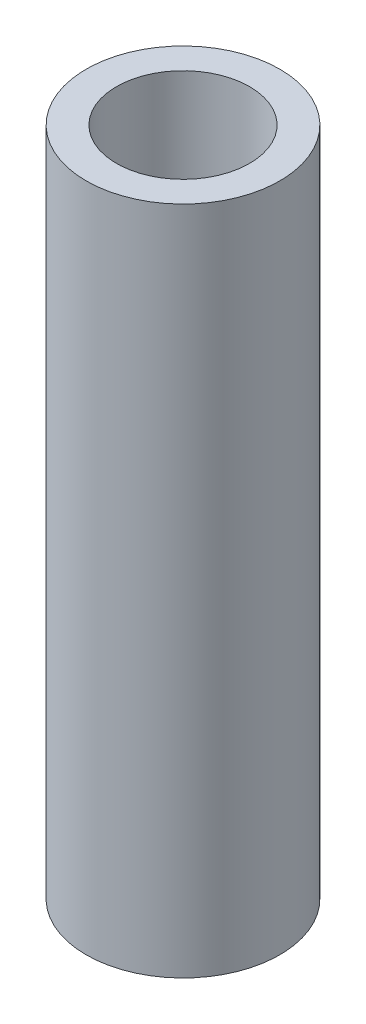
from build123d import *

# Parameters (mm, degrees)
SKETCH1_R           = 6.5
SKETCH1_R_2         = 4.468
BOSS_EXTRUDE1_DEPTH = 45


with BuildPart() as part:
    # Sketch1 → Boss-Extrude1 (new body)
    with BuildSketch(Plane(origin=(0, 0, 0), x_dir=(1, 0, 0), z_dir=(0, 1, 0))):
        with Locations(Location((0, 0, 0), (0, 0, 90))):
            Circle(SKETCH1_R)
        with Locations(Location((0, 0, 0), (0, 0, 90))):
            Circle(SKETCH1_R_2, mode=Mode.SUBTRACT)
    extrude(amount=BOSS_EXTRUDE1_DEPTH)


solid = part.part
